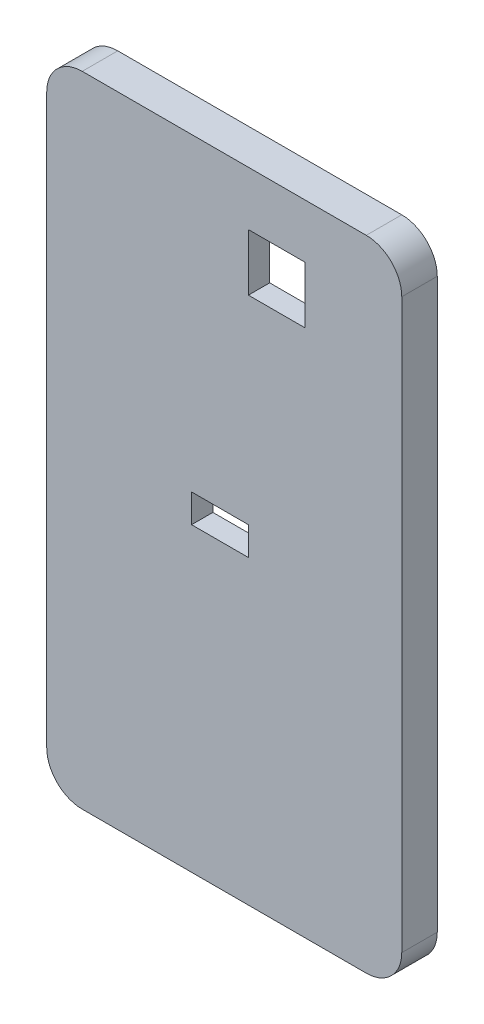
from build123d import *

# Parameters (mm, degrees)
SKETCH2_W           = 63.5
SKETCH2_H           = 114.3
BOSS_EXTRUDE1_DEPTH = 6.35
FILLET1_R           = 6.35
CUT_EXTRUDE2_DEPTH  = 2.54
SKETCH8_W           = 10.16
SKETCH8_H           = 10.16
CUT_EXTRUDE3_DEPTH  = 131.81
SKETCH7_W           = 10.16
SKETCH7_H           = 5.08
CUT_EXTRUDE4_DEPTH  = 131.81


with BuildPart() as part:
    # Sketch2 → Boss-Extrude1 (new body)
    with BuildSketch(Plane.XY):
        with Locations((31.75, -57.15)):
            Rectangle(SKETCH2_W, SKETCH2_H)
    extrude(amount=BOSS_EXTRUDE1_DEPTH)

    # Fillet1
    fillet1_edges = [part.edges().sort_by_distance(p)[0] for p in [
        (0, 0, 3.175),
        (63.5, 0, 3.175),
        (63.5, -114.3, 3.175),
        (0, -114.3, 3.175),
    ]]
    fillet(fillet1_edges, radius=FILLET1_R)

    # Sketch5 → Cut-Extrude2 (cut)
    with BuildSketch(Plane(origin=(0, 0, 0), x_dir=(-1, 0, 0), z_dir=(0, 0, -1))):
        with BuildLine():
            Line((-60.96, -6.453652416), (-60.96, -107.95))
            ThreePointArc((-60.96, -107.95), (-59.844076836, -110.644076836), (-57.15, -111.76))
            Line((-57.15, -111.76), (-6.35, -111.76))
            ThreePointArc((-6.35, -111.76), (-3.655923164, -110.644076836), (-2.54, -107.95))
            Line((-2.54, -107.95), (-2.54, -6.35))
            ThreePointArc((-2.54, -6.35), (-3.655923164, -3.655923164), (-6.35, -2.54))
            Line((-6.35, -2.54), (-57.15, -2.54))
            ThreePointArc((-57.15, -2.54), (-59.881396091, -3.692317076), (-60.96, -6.453652416))
        make_face()
    extrude(amount=-CUT_EXTRUDE2_DEPTH, mode=Mode.SUBTRACT)

    # Sketch8 → Cut-Extrude3 (cut, through all)
    with BuildSketch(Plane(origin=(0, 0, 2.54), x_dir=(-1, 0, 0), z_dir=(0, 0, -1))):
        with Locations((-41.148, -14.732)):
            Rectangle(SKETCH8_W, SKETCH8_H)
    extrude(amount=-CUT_EXTRUDE3_DEPTH, mode=Mode.SUBTRACT)

    # Sketch7 → Cut-Extrude4 (cut, through all)
    with BuildSketch(Plane(origin=(0, 0, 2.54), x_dir=(-1, 0, 0), z_dir=(0, 0, -1))):
        with Locations((-30.988, -57.912)):
            Rectangle(SKETCH7_W, SKETCH7_H)
    extrude(amount=-CUT_EXTRUDE4_DEPTH, mode=Mode.SUBTRACT)


solid = part.part
